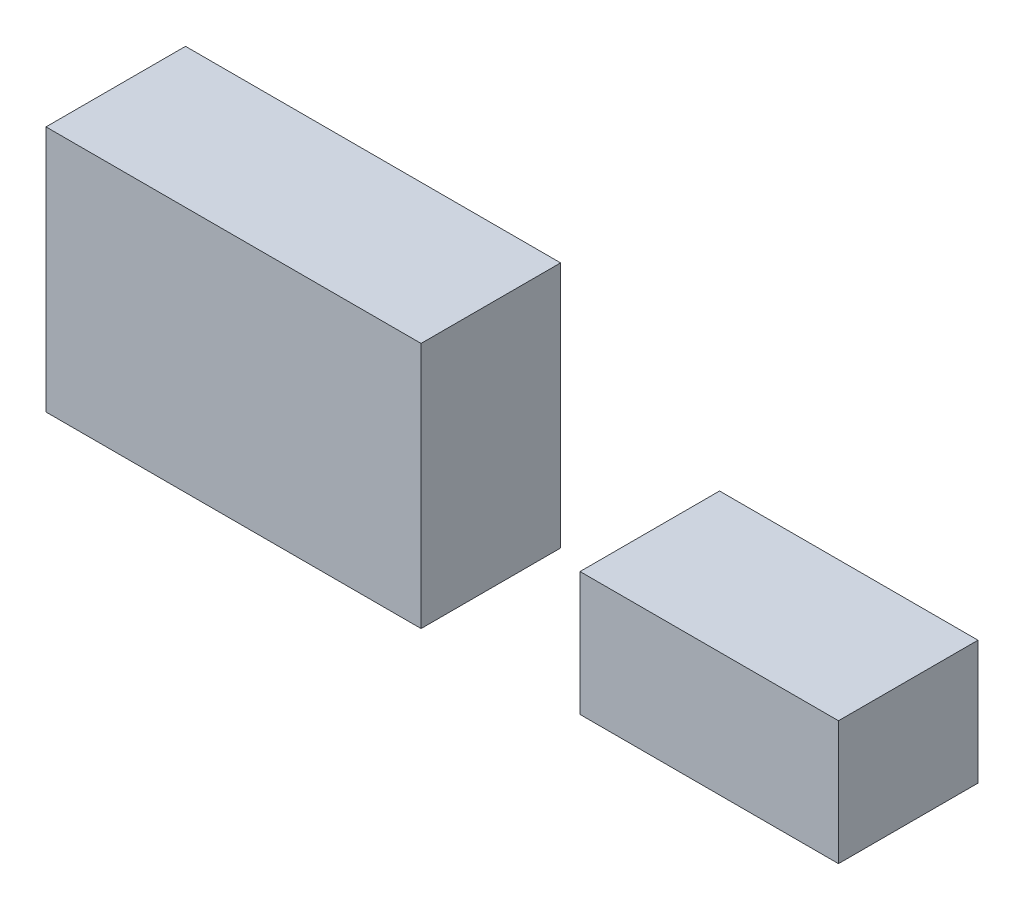
from build123d import *

# Parameters (mm, degrees)
SKETCH_1_W      = 166.680268691
SKETCH_1_H      = 109.7507403
EXTRUDE_1_DEPTH = 62
SKETCH_2_W      = 114.853238835
SKETCH_2_H      = 55.012384129
EXTRUDE_2_DEPTH = 62


with BuildPart() as part:
    # 草图1 → 凸台-拉伸1 (new body)
    with BuildSketch(Plane.XY):
        with Locations((-58.1033331, 20.835033586)):
            Rectangle(SKETCH_1_W, SKETCH_1_H)
    extrude(amount=EXTRUDE_1_DEPTH)


with BuildPart() as body_2:
    # 草图2 → 凸台-拉伸2 (new body)
    with BuildSketch(Plane.XY):
        with Locations((153.303274428, -4.264713597)):
            Rectangle(SKETCH_2_W, SKETCH_2_H)
    extrude(amount=EXTRUDE_2_DEPTH)


solid = Compound([part.part, body_2.part])
